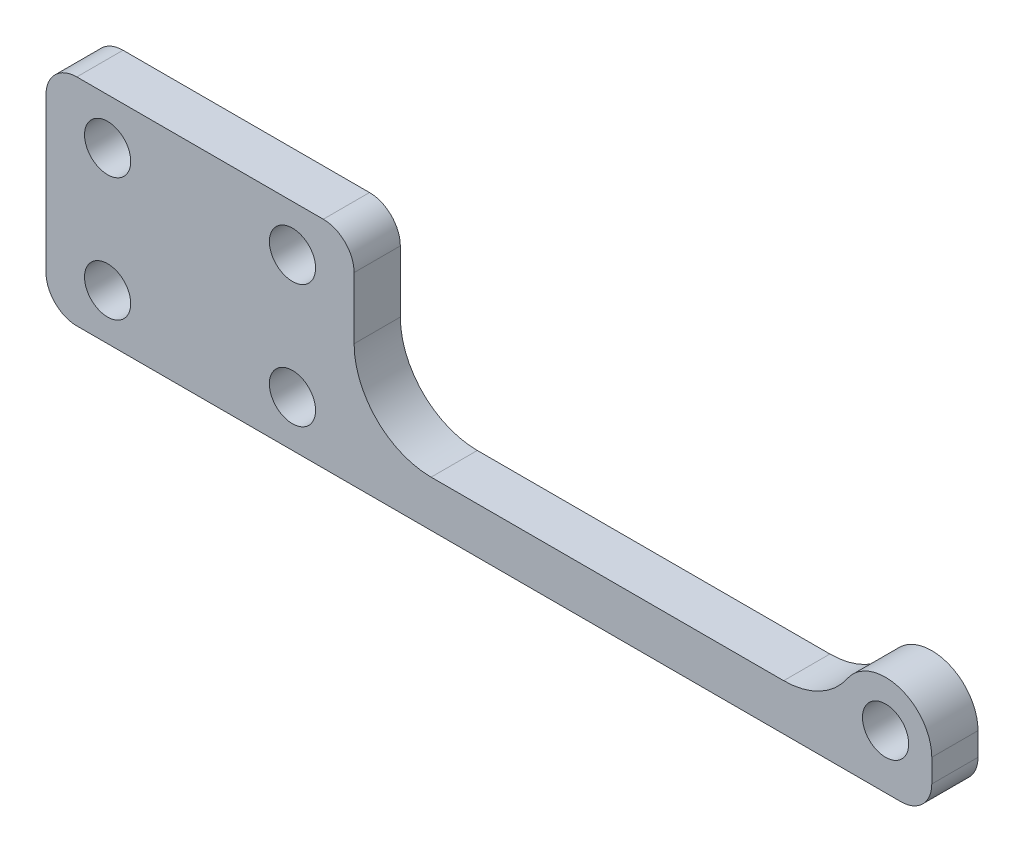
from build123d import *

# Parameters (mm, degrees)
SZKIC1_W                    = 20
SZKIC1_H                    = 14
SZKIC1_R                    = 1.5
DODANIE_WYCI_GNI_CIE1_DEPTH = 3
ZAOKR_GLENIE5_R             = 2
ZAOKR_GLENIE6_R             = 5


with BuildPart() as part:
    # Szkic1 → Dodanie-wyciągnięcie1 (new body)
    # profile 1 of 2: a face of its own
    with BuildSketch(Plane.XY):
        Rectangle(SZKIC1_W, SZKIC1_H)
        with Locations((-6, -4)):
            Circle(SZKIC1_R, mode=Mode.SUBTRACT)
        with Locations((6, -4)):
            Circle(SZKIC1_R, mode=Mode.SUBTRACT)
        with Locations((6, 4)):
            Circle(SZKIC1_R, mode=Mode.SUBTRACT)
        with Locations((-6, 4)):
            Circle(SZKIC1_R, mode=Mode.SUBTRACT)
    # profile 2 of 2: a face of its own
    with BuildSketch(Plane.XY):
        with BuildLine():
            Line((10, -4), (10, -7))
            Line((10, -7), (47.5, -7))
            Line((47.5, -7), (47.5, -3.5))
            ThreePointArc((47.5, -3.5), (44.249121219, -0.510508432), (41.541960108, -4))
            Line((41.541960108, -4), (10, -4))
        make_face()
        with Locations((44.5, -3.5)):
            Circle(SZKIC1_R, mode=Mode.SUBTRACT)
    extrude(amount=DODANIE_WYCI_GNI_CIE1_DEPTH)

    # Zaokrąglenie5
    zaokr_glenie5_edges = [part.edges().sort_by_distance(p)[0] for p in [
        (-10, 7, 1.5),
        (10, 7, 1.5),
        (47.5, -7, 1.5),
        (-10, -7, 1.5),
    ]]
    fillet(zaokr_glenie5_edges, radius=ZAOKR_GLENIE5_R)

    # Zaokrąglenie6
    zaokr_glenie6_edges = [part.edges().sort_by_distance(p)[0] for p in [
        (10, -4, 1.5),
        (41.541960108, -4, 1.5),
    ]]
    fillet(zaokr_glenie6_edges, radius=ZAOKR_GLENIE6_R)


solid = part.part
